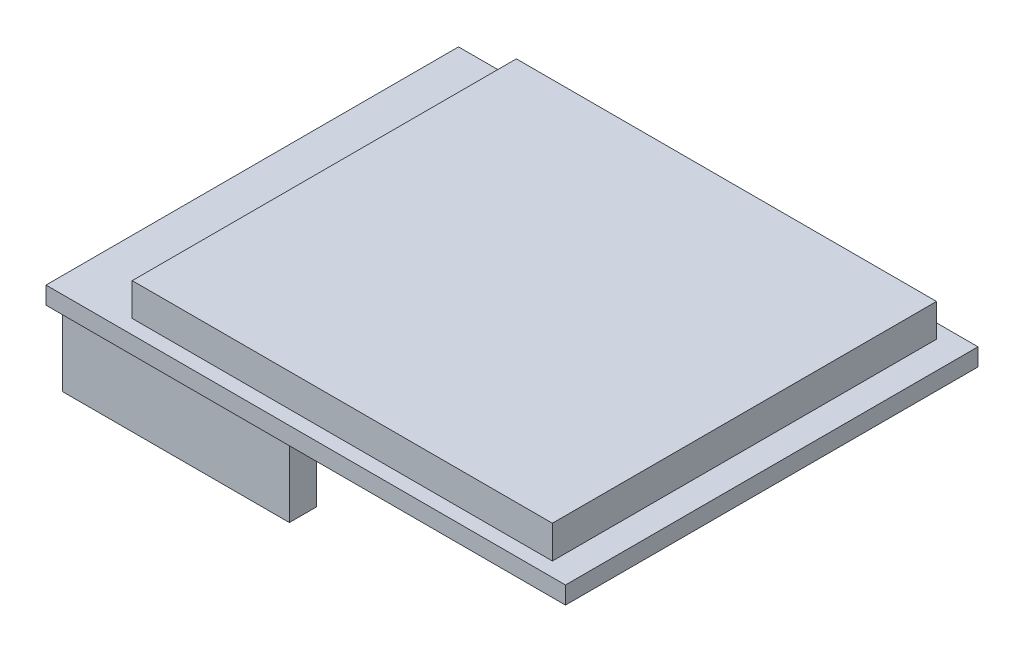
from build123d import *

# Parameters (mm, degrees)
SKETCH1_W             = 47.6
SKETCH1_H             = 37.8
BOSS_EXTRUDE1_DEPTH   = 1.6
SKETCH2_W             = 38.5
SKETCH2_H             = 35.2
BOSS_EXTRUDE2_DEPTH   = 3
SKETCH3_W             = 20.8
SKETCH3_H             = 2.5
BOSS_EXTRUDE3_DEPTH   = 7.6
BOSS_EXTRUDE3_2_DEPTH = 7.6


with BuildPart() as part:
    # Sketch1 → Boss-Extrude1 (new body)
    with BuildSketch(Plane(origin=(0, 0, 0), x_dir=(1, 0, 0), z_dir=(0, 1, 0))):
        Rectangle(SKETCH1_W, SKETCH1_H)
    extrude(amount=BOSS_EXTRUDE1_DEPTH)


with BuildPart() as body_2:
    # Sketch2 → Boss-Extrude2 (new body)
    with BuildSketch(Plane(origin=(0, 1.6, 0), x_dir=(1, 0, 0), z_dir=(0, 1, 0))):
        with Locations((2.05, 0)):
            Rectangle(SKETCH2_W, SKETCH2_H)
    extrude(amount=BOSS_EXTRUDE2_DEPTH)


with BuildPart() as body_3:
    # Sketch3 → Boss-Extrude3 (new body)
    with BuildSketch(Plane.XZ):
        with Locations((-13.4, 16.15)):
            Rectangle(SKETCH3_W, SKETCH3_H)
    extrude(amount=BOSS_EXTRUDE3_DEPTH)


with BuildPart() as body_4:
    # Sketch3 → Boss-Extrude3 2 (new body)
    with BuildSketch(Plane.XZ):
        with Locations((-13.4, -16.15)):
            Rectangle(SKETCH3_W, SKETCH3_H)
    extrude(amount=BOSS_EXTRUDE3_2_DEPTH)


solid = Compound([part.part, body_2.part, body_3.part, body_4.part])
